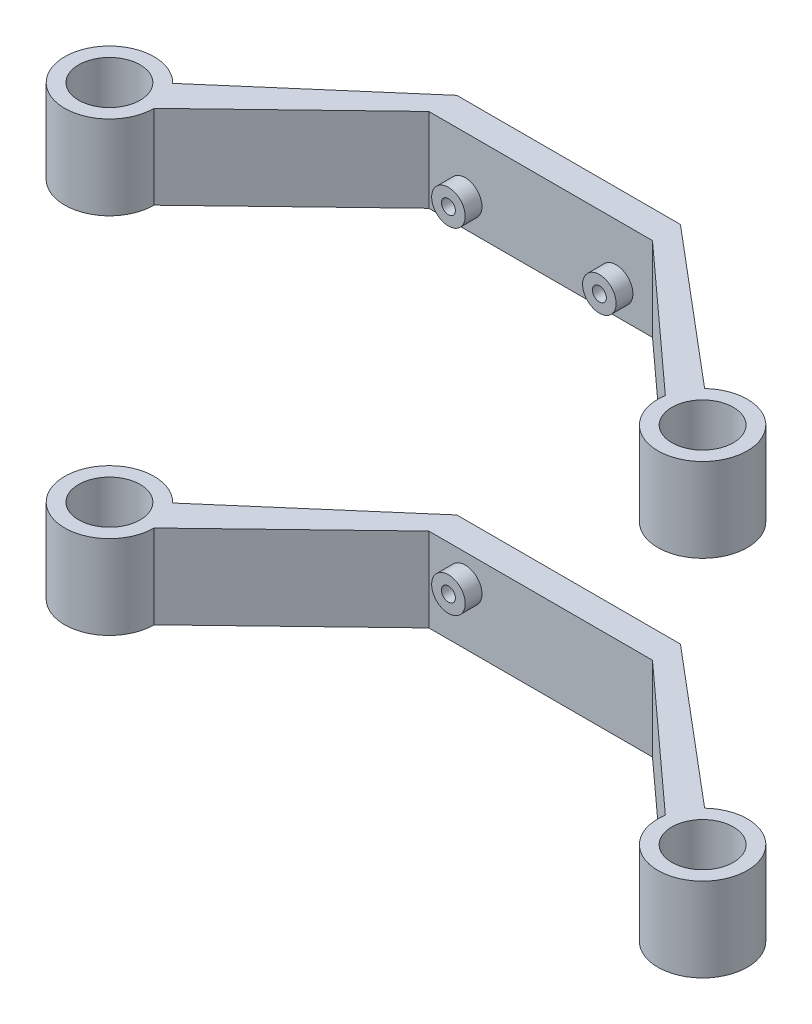
from build123d import *

# Parameters (mm, degrees)
SKETCH1_W           = 40
SKETCH1_H           = 80
BOSS_EXTRUDE1_DEPTH = 3
SKETCH2_R           = 3
SKETCH2_R_2         = 1.25
BOSS_EXTRUDE2_DEPTH = 5
SKETCH3_R           = 5.5
BOSS_EXTRUDE3_DEPTH = 15
LPATTERN1_COUNT     = 2
LPATTERN1_PITCH     = 65
SKETCH4_W           = 56.102770757
SKETCH4_H           = 50
CUT_EXTRUDE1_DEPTH  = 119.314928378


with BuildPart() as part:
    # Sketch1 → Boss-Extrude1 (new body)
    with BuildSketch(Plane.XY):
        with Locations((20, -40)):
            Rectangle(SKETCH1_W, SKETCH1_H)
    extrude(amount=BOSS_EXTRUDE1_DEPTH)

    # Sketch2 → Boss-Extrude2 (add)
    # profile 1 of 3: a face of its own
    with BuildSketch(Plane.XY.offset(3)):
        with Locations((6.5, -10)):
            Circle(SKETCH2_R)
        with Locations((6.5, -10)):
            Circle(SKETCH2_R_2, mode=Mode.SUBTRACT)
    # profile 2 of 3: a face of its own
    with BuildSketch(Plane.XY.offset(3)):
        with Locations((33.5, -10)):
            Circle(SKETCH2_R)
        with Locations((33.5, -10)):
            Circle(SKETCH2_R_2, mode=Mode.SUBTRACT)
    # profile 3 of 3: a face of its own
    with BuildSketch(Plane.XY.offset(3)):
        with Locations((6.5, -70)):
            Circle(SKETCH2_R)
        with Locations((6.5, -70)):
            Circle(SKETCH2_R_2, mode=Mode.SUBTRACT)
    extrude(amount=BOSS_EXTRUDE2_DEPTH)

    # Sketch3 → Boss-Extrude3 (add)
    with BuildSketch(Plane(origin=(0, 0, 0), x_dir=(1, 0, 0), z_dir=(0, 1, 0))):
        with BuildLine():
            Line((67.575216761, -23.249768733), (40, 0))
            Line((40, 0), (0, 0))
            Line((0, 0), (-27.263861108, -23.558468907))
            ThreePointArc((-27.263861108, -23.558468907), (-40.475938026, -32.058823719), (-25.05, -29.08301384))
            Line((-25.05, -29.08301384), (0, -5))
            Line((0, -5), (40, -5))
            Line((40, -5), (65.146126602, -27.84657326))
            ThreePointArc((65.146126602, -27.84657326), (80.123172295, -32.820691419), (67.575216761, -23.249768733))
        make_face()
        with Locations(Location((-33.05, -29.08301384, 0), (0, 0, 270))):
            Circle(SKETCH3_R, mode=Mode.SUBTRACT)
        with Locations(Location((73.05, -29.08301384, 0), (0, 0, 270))):
            Circle(SKETCH3_R, mode=Mode.SUBTRACT)
    boss_extrude3 = extrude(amount=-BOSS_EXTRUDE3_DEPTH)

    # LPattern1: Boss-Extrude3 ×2
    with Locations(*[(0, -i * LPATTERN1_PITCH, 0) for i in range(1, LPATTERN1_COUNT)]):
        add(boss_extrude3)

    # Sketch4 → Cut-Extrude1 (cut, through all)
    with BuildSketch(Plane.XY.offset(5)):
        with Locations((20.812178196, -40)):
            Rectangle(SKETCH4_W, SKETCH4_H)
    extrude(amount=-CUT_EXTRUDE1_DEPTH, mode=Mode.SUBTRACT)


with BuildPart() as cut_extrude1_piece_1:
    # of the separate pieces the step leaves, piece 1, a body of its own (cut_extrude1_pieces)
    add(part.part.solids().sort_by_distance((0, 0, 0))[0])


with BuildPart() as cut_extrude1_piece_2:
    # of the separate pieces the step leaves, piece 2, a body of its own (cut_extrude1_pieces)
    add(part.part.solids().sort_by_distance((0, -80, 0))[0])


solid = Compound([cut_extrude1_piece_1.part, cut_extrude1_piece_2.part])
